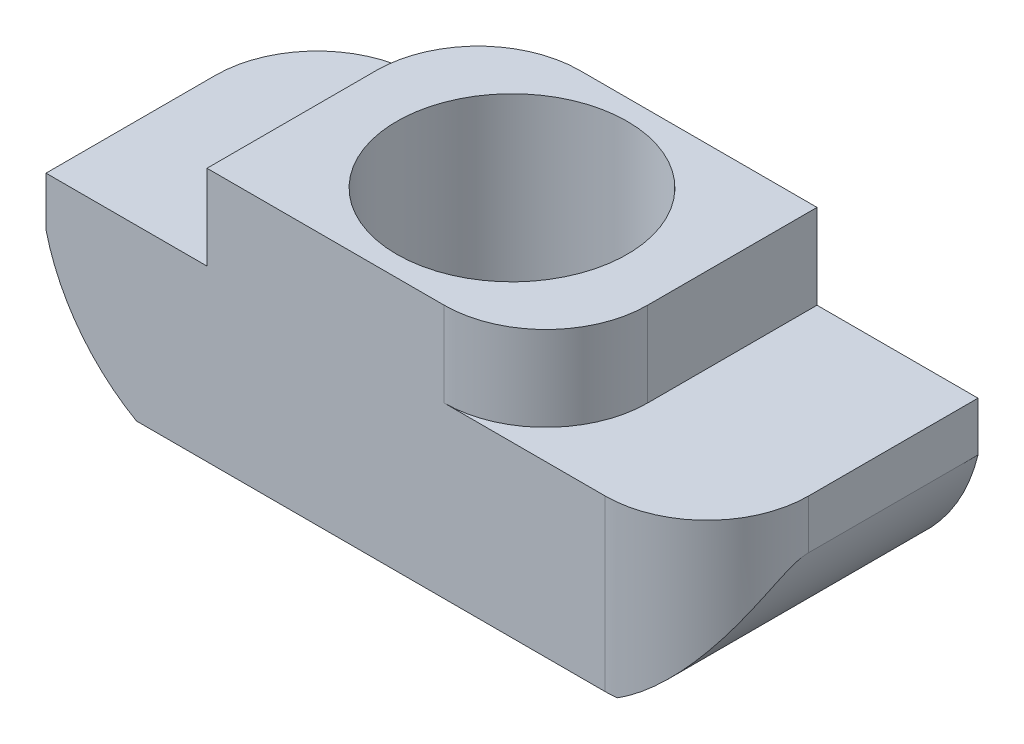
from build123d import *

# Parameters (mm, degrees)
EXTRUDE_1_DEPTH        = 4
SKETCH_3_W             = 10
SKETCH_3_H             = 2.5
EXTRUDE_2_DEPTH        = 4
FILLET_1_R             = 3
HOLE_WIZARD_M8_1_D     = 6.8
HOLE_WIZARD_M8_1_DEPTH = 19.75
HOLE_WIZARD_M8_1_TIP   = 2.042926105


with BuildPart() as part:
    # 草图1 → 凸台-拉伸1 (new, symmetric)
    with BuildSketch(Plane.XY):
        with BuildLine():
            Line((16.832132438, -5), (2.667867562, -5))
            ThreePointArc((2.667867562, -5), (0.969162586, -3.499129927), (0, -1.45))
            Line((0, -1.45), (0, 0))
            Line((0, 0), (19.5, 0))
            Line((19.5, 0), (19.5, -1.45))
            ThreePointArc((19.5, -1.45), (18.530837414, -3.499129927), (16.832132438, -5))
        make_face()
    extrude(amount=EXTRUDE_1_DEPTH, both=True)

    # 草图3 → 凸台-拉伸2 (add, symmetric)
    with BuildSketch(Plane.XY):
        with Locations((9.75, 1.25)):
            Rectangle(SKETCH_3_W, SKETCH_3_H)
    extrude(amount=EXTRUDE_2_DEPTH, both=True)

    # 圆角1
    fillet_1_edges = [part.edges().sort_by_distance(p)[0] for p in [
        (19.5, -0.725, 4),
        (0, -0.725, -4),
        (4.75, 1.25, -4),
        (14.75, 1.25, 4),
    ]]
    fillet(fillet_1_edges, radius=FILLET_1_R)

    # M8 螺纹孔1
    with Locations(Plane(origin=(9.75, 2.5, 0), x_dir=(0, 0, 1), z_dir=(0, 1, 0))):
        with Locations((0, 0)):
            Hole(HOLE_WIZARD_M8_1_D / 2, depth=HOLE_WIZARD_M8_1_DEPTH)
            with Locations((0, 0, -(HOLE_WIZARD_M8_1_DEPTH + HOLE_WIZARD_M8_1_TIP / 2))):  # 118° drill point
                Cone(0, HOLE_WIZARD_M8_1_D / 2, HOLE_WIZARD_M8_1_TIP, mode=Mode.SUBTRACT)


solid = part.part
